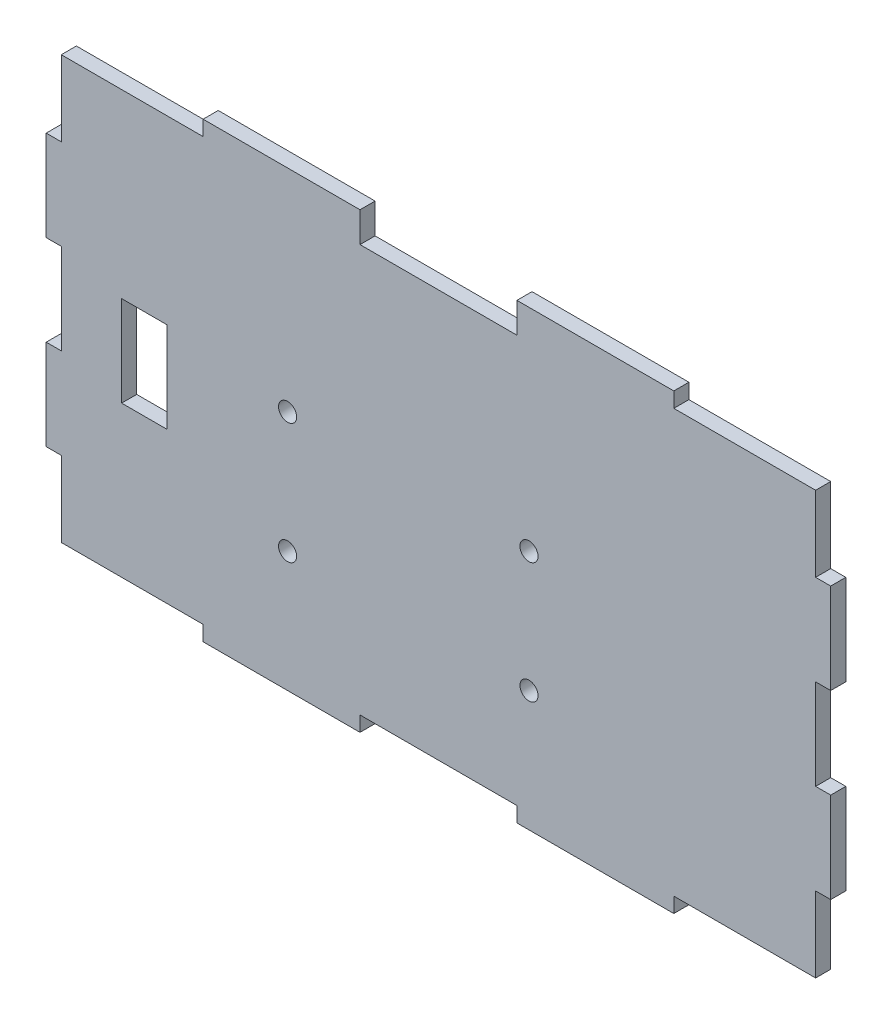
from build123d import *

# Parameters (mm, degrees)
SALIENTE_EXTRUIR1_DEPTH = 5
CROQUIS2_W              = 52
CROQUIS2_H              = 5
CORTAR_EXTRUIR1_DEPTH   = 10
CROQUIS3_R              = 3
CORTAR_EXTRUIR2_DEPTH   = 10
CROQUIS4_W              = 15
CROQUIS4_H              = 30
CORTAR_EXTRUIR3_DEPTH   = 10


with BuildPart() as part:
    # Croquis1 → Saliente-Extruir1 (new body)
    with BuildSketch(Plane.XY):
        Polygon((52, 0), (104, 0), (104, 5), (156, 5), (156, 0), (208, 0), (208, 5), (255, 5), (255, 30), (260, 30), (260, 60), (255, 60), (255, 90), (260, 90), (260, 120), (255, 120), (255, 145), (208, 145), (208, 150), (156, 150), (156, 145), (104, 145), (104, 150), (52, 150), (52, 145), (5, 145), (5, 120), (0, 120), (0, 90), (5, 90), (5, 60), (0, 60), (0, 30), (5, 30), (5, 5), (52, 5), align=None)
    extrude(amount=SALIENTE_EXTRUIR1_DEPTH)

    # Croquis2 → Cortar-Extruir1 (cut)
    with BuildSketch(Plane.XY.offset(5)):
        with Locations((130, 142.5)):
            Rectangle(CROQUIS2_W, CROQUIS2_H)
    extrude(amount=-CORTAR_EXTRUIR1_DEPTH, mode=Mode.SUBTRACT)

    # Croquis3 → Cortar-Extruir2 (cut)
    with BuildSketch(Plane.XY.offset(5)):
        with Locations((160, 40)):
            Circle(CROQUIS3_R)
        with Locations((80, 40)):
            Circle(CROQUIS3_R)
        with Locations((80, 80)):
            Circle(CROQUIS3_R)
        with Locations((160, 80)):
            Circle(CROQUIS3_R)
    extrude(amount=-CORTAR_EXTRUIR2_DEPTH, mode=Mode.SUBTRACT)

    # Croquis4 → Cortar-Extruir3 (cut)
    with BuildSketch(Plane.XY.offset(5)):
        with Locations((32.5, 70)):
            Rectangle(CROQUIS4_W, CROQUIS4_H)
    extrude(amount=-CORTAR_EXTRUIR3_DEPTH, mode=Mode.SUBTRACT)


solid = part.part
